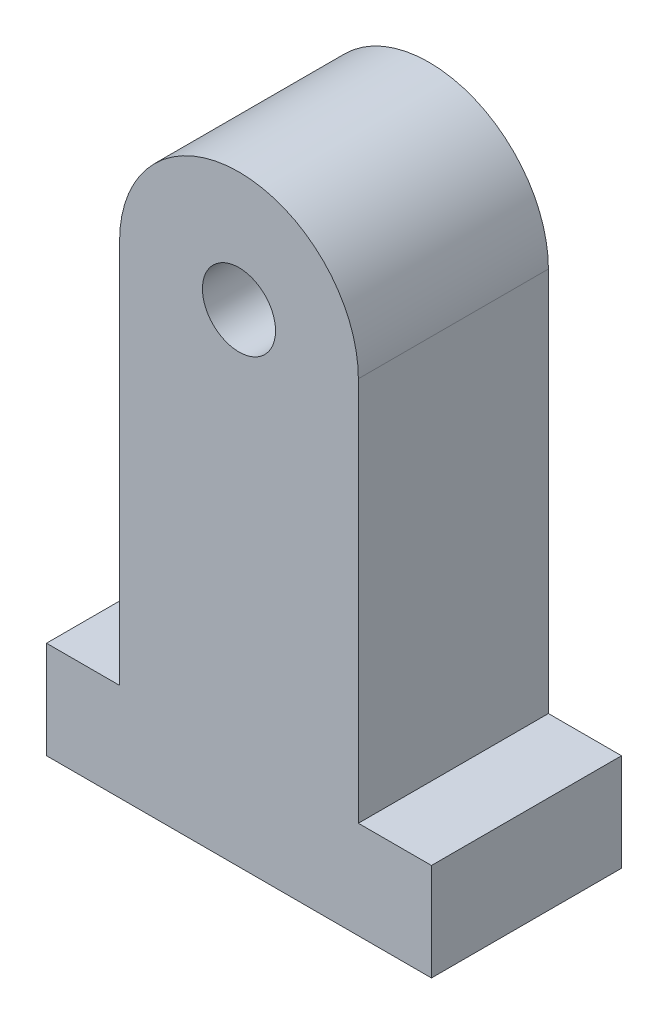
from build123d import *

# Parameters (mm, degrees)
SKETCH1_R           = 1.905
BOSS_EXTRUDE1_DEPTH = 4.953


with BuildPart() as part:
    # Sketch1 → Boss-Extrude1 (new, symmetric)
    with BuildSketch(Plane.XY):
        with BuildLine():
            Line((10.033, 0), (-10.033, 0))
            Line((-10.033, 0), (-10.033, 5.08))
            Line((-10.033, 5.08), (-6.223, 5.08))
            Line((-6.223, 5.08), (-6.223, 25.146))
            ThreePointArc((-6.223, 25.146), (0, 31.369), (6.223, 25.146))
            Line((6.223, 25.146), (6.223, 5.08))
            Line((6.223, 5.08), (10.033, 5.08))
            Line((10.033, 5.08), (10.033, 0))
        make_face()
        with Locations((0, 25.146)):
            Circle(SKETCH1_R, mode=Mode.SUBTRACT)
    extrude(amount=BOSS_EXTRUDE1_DEPTH, both=True)


solid = part.part
